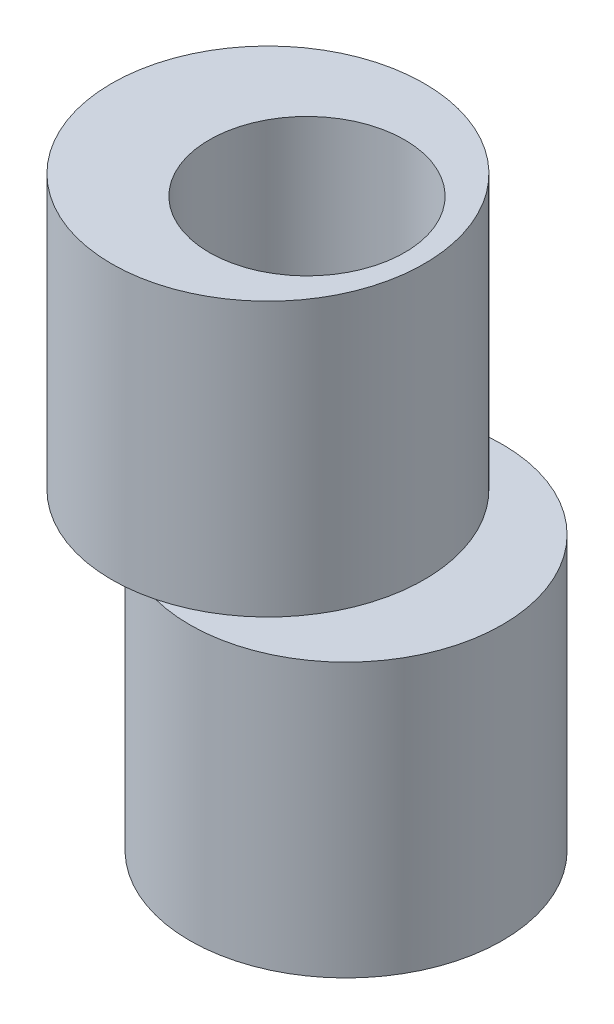
from build123d import *

# Parameters (mm, degrees)
SKETCH2_R           = 4
SKETCH2_R_2         = 2.5
BOSS_EXTRUDE1_DEPTH = 7
SKETCH3_R           = 4
SKETCH3_R_2         = 2.5
BOSS_EXTRUDE2_DEPTH = 7


with BuildPart() as part:
    # Sketch2 → Boss-Extrude1 (new body)
    with BuildSketch(Plane(origin=(0, 0, 0), x_dir=(1, 0, 0), z_dir=(0, 1, 0))):
        with Locations(Location((1, 0, 0), (0, 0, 270))):
            Circle(SKETCH2_R)
        with Locations(Location((0, 0, 0), (0, 0, 270))):
            Circle(SKETCH2_R_2, mode=Mode.SUBTRACT)
    extrude(amount=BOSS_EXTRUDE1_DEPTH)

    # Sketch3 → Boss-Extrude2 (add)
    with BuildSketch(Plane(origin=(0, 7, 0), x_dir=(1, 0, 0), z_dir=(0, 1, 0))):
        with Locations(Location((-1, 0, 0), (0, 0, 75.522487814))):
            Circle(SKETCH3_R)
        with Locations(Location((0, 0, 0), (0, 0, 270))):
            Circle(SKETCH3_R_2, mode=Mode.SUBTRACT)
    extrude(amount=BOSS_EXTRUDE2_DEPTH)


solid = part.part
